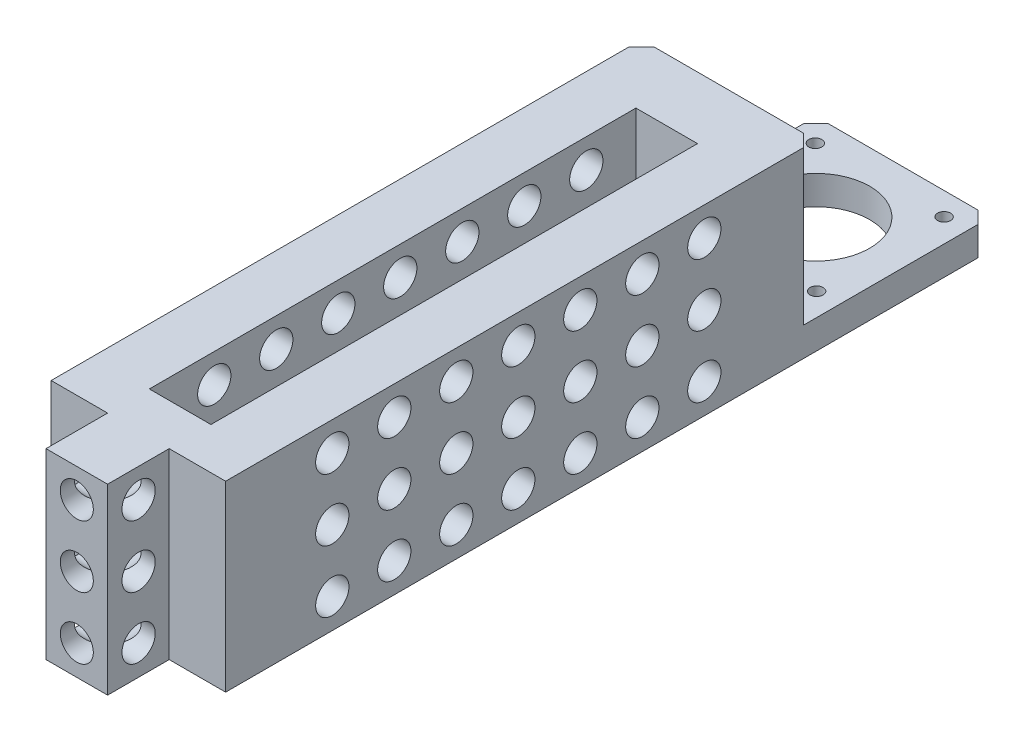
from build123d import *

# Parameters (mm, degrees)
SKETCH1_W           = 14.9
SKETCH1_H           = 117.7
BOSS_EXTRUDE1_DEPTH = 44.2
SKETCH2_W           = 42.2
SKETCH2_H           = 42.2
CUT_EXTRUDE1_DEPTH  = 37.2
SKETCH3_R           = 13
SKETCH3_R_2         = 1.575
SKETCH3_R_3         = 4.1
CUT_EXTRUDE2_DEPTH  = 30
SKETCH5_R           = 4.025
CUT_EXTRUDE3_DEPTH  = 55
SKETCH6_R           = 4
CUT_EXTRUDE4_DEPTH  = 25
CHAMFER1_SIZE       = 3


with BuildPart() as part:
    # Sketch1 → Boss-Extrude1 (new body)
    with BuildSketch(Plane(origin=(0, 0, 0), x_dir=(1, 0, 0), z_dir=(0, 1, 0))):
        Polygon((0, 0), (-42.2, 0), (-42.2, -185), (-28.55, -185), (-28.55, -199.9), (-13.65, -199.9), (-13.65, -185), (0, -185), align=None)
        with Locations((-21.1, -116.05)):
            Rectangle(SKETCH1_W, SKETCH1_H, mode=Mode.SUBTRACT)
    extrude(amount=BOSS_EXTRUDE1_DEPTH)

    # Sketch2 → Cut-Extrude1 (cut)
    with BuildSketch(Plane(origin=(0, 44.2, 0), x_dir=(1, 0, 0), z_dir=(0, 1, 0))):
        with Locations((-21.1, -21.1)):
            Rectangle(SKETCH2_W, SKETCH2_H)
    extrude(amount=-CUT_EXTRUDE1_DEPTH, mode=Mode.SUBTRACT)

    # Sketch3 → Cut-Extrude2 (cut)
    with BuildSketch(Plane.XZ):
        with Locations(Location((-21.1, 21.1, 0), (0, 0, 270))):
            Circle(SKETCH3_R)
        with Locations(Location((-36.519316662, 36.680683338, 0), (0, 0, 270))):
            Circle(SKETCH3_R_2)
        with Locations(Location((-5.519316662, 36.519316662, 0), (0, 0, 270))):
            Circle(SKETCH3_R_2)
        with Locations(Location((-5.680683338, 5.519316662, 0), (0, 0, 270))):
            Circle(SKETCH3_R_2)
        with Locations(Location((-36.680683338, 5.680683338, 0), (0, 0, 270))):
            Circle(SKETCH3_R_2)
        with Locations(Location((-21.1, 50, 0), (0, 0, 270))):
            Circle(SKETCH3_R_3)
        with Locations(Location((-5.6, 50, 0), (0, 0, 270))):
            Circle(SKETCH3_R_3)
        with Locations(Location((-36.6, 50, 0), (0, 0, 270))):
            Circle(SKETCH3_R_3)
    extrude(amount=-CUT_EXTRUDE2_DEPTH, mode=Mode.SUBTRACT)

    # Sketch5 → Cut-Extrude3 (cut)
    with BuildSketch(Plane(origin=(0, 0, 0), x_dir=(0, 0, -1), z_dir=(1, 0, 0))):
        with Locations((-69.2, 37.2)):
            Circle(SKETCH5_R)
        with Locations((-84.2, 37.2)):
            Circle(SKETCH5_R)
        with Locations((-99.2, 37.2)):
            Circle(SKETCH5_R)
        with Locations((-114.2, 37.2)):
            Circle(SKETCH5_R)
        with Locations((-84.2, 22.2)):
            Circle(SKETCH5_R)
        with Locations((-99.2, 22.2)):
            Circle(SKETCH5_R)
        with Locations((-114.2, 22.2)):
            Circle(SKETCH5_R)
        with Locations((-84.2, 7.2)):
            Circle(SKETCH5_R)
        with Locations((-99.2, 7.2)):
            Circle(SKETCH5_R)
        with Locations((-114.2, 7.2)):
            Circle(SKETCH5_R)
        with Locations((-69.2, 22.2)):
            Circle(SKETCH5_R)
        with Locations((-69.2, 7.2)):
            Circle(SKETCH5_R)
        with Locations((-192.4, 37.2)):
            Circle(SKETCH5_R)
        with Locations((-192.4, 22.2)):
            Circle(SKETCH5_R)
        with Locations((-192.4, 7.2)):
            Circle(SKETCH5_R)
        with Locations((-129.2, 37.2)):
            Circle(SKETCH5_R)
        with Locations((-144.2, 37.2)):
            Circle(SKETCH5_R)
        with Locations((-159.2, 37.2)):
            Circle(SKETCH5_R)
        with Locations((-129.2, 22.2)):
            Circle(SKETCH5_R)
        with Locations((-144.2, 22.2)):
            Circle(SKETCH5_R)
        with Locations((-159.2, 22.2)):
            Circle(SKETCH5_R)
        with Locations((-129.2, 7.2)):
            Circle(SKETCH5_R)
        with Locations((-144.2, 7.2)):
            Circle(SKETCH5_R)
        with Locations((-159.2, 7.2)):
            Circle(SKETCH5_R)
    extrude(amount=-CUT_EXTRUDE3_DEPTH, mode=Mode.SUBTRACT)

    # Sketch6 → Cut-Extrude4 (cut)
    with BuildSketch(Plane.XY.offset(199.9)):
        with Locations((-21.1, 37.2)):
            Circle(SKETCH6_R)
        with Locations((-21.1, 22.2)):
            Circle(SKETCH6_R)
        with Locations((-21.1, 7.2)):
            Circle(SKETCH6_R)
    extrude(amount=-CUT_EXTRUDE4_DEPTH, mode=Mode.SUBTRACT)

    # Chamfer1
    chamfer1_edges = [part.edges().sort_by_distance(p)[0] for p in [
        (-42.2, 3.5, 0),
        (0, 3.5, 0),
        (-42.2, 25.6, 42.2),
        (0, 25.6, 42.2),
    ]]
    chamfer(chamfer1_edges, length=CHAMFER1_SIZE)


solid = part.part
